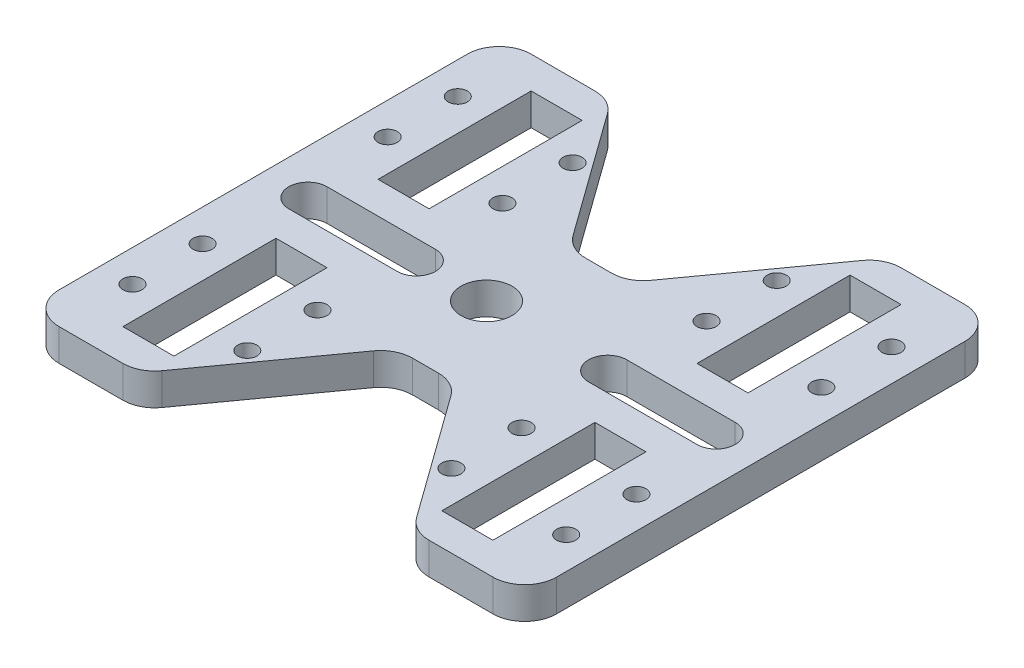
from build123d import *

# Parameters (mm, degrees)
ESBO_O1_W                = 78
ESBO_O1_H                = 74
ESBO_O1_R                = 1.5
ESBO_O1_W_2              = 8
ESBO_O1_H_2              = 24
RESSALTO_EXTRUS_O1_DEPTH = 2.5
CORTE_EXTRUS_O1_DEPTH    = 54.990739947
ESBO_O3_R                = 4
CORTE_EXTRUS_O2_DEPTH    = 10
FILETE1_R                = 5


with BuildPart() as part:
    # Esboço1 → Ressalto-extrusão1 (new, symmetric)
    with BuildSketch(Plane(origin=(0, 0, 0), x_dir=(1, 0, 0), z_dir=(0, 1, 0))):
        Rectangle(ESBO_O1_W, ESBO_O1_H)
        with Locations(Location((-34, 25.5, 0), (0, 0, 270))):
            Circle(ESBO_O1_R, mode=Mode.SUBTRACT)
        with Locations(Location((-16, 25.5, 0), (0, 0, 90))):
            Circle(ESBO_O1_R, mode=Mode.SUBTRACT)
        with Locations(Location((-16, 14.5, 0), (0, 0, 270))):
            Circle(ESBO_O1_R, mode=Mode.SUBTRACT)
        with Locations(Location((-34, 14.5, 0), (0, 0, 90))):
            Circle(ESBO_O1_R, mode=Mode.SUBTRACT)
        with Locations(Location((16, 14.5, 0), (0, 0, 90))):
            Circle(ESBO_O1_R, mode=Mode.SUBTRACT)
        with Locations(Location((16, 25.5, 0), (0, 0, 270))):
            Circle(ESBO_O1_R, mode=Mode.SUBTRACT)
        with Locations(Location((34, 14.5, 0), (0, 0, 270))):
            Circle(ESBO_O1_R, mode=Mode.SUBTRACT)
        with Locations(Location((34, 25.5, 0), (0, 0, 90))):
            Circle(ESBO_O1_R, mode=Mode.SUBTRACT)
        with Locations(Location((34, -14.5, 0), (0, 0, 90))):
            Circle(ESBO_O1_R, mode=Mode.SUBTRACT)
        with Locations(Location((16, -14.5, 0), (0, 0, 270))):
            Circle(ESBO_O1_R, mode=Mode.SUBTRACT)
        with Locations(Location((34, -25.5, 0), (0, 0, 270))):
            Circle(ESBO_O1_R, mode=Mode.SUBTRACT)
        with Locations(Location((16, -25.5, 0), (0, 0, 90))):
            Circle(ESBO_O1_R, mode=Mode.SUBTRACT)
        with Locations(Location((-16, -14.5, 0), (0, 0, 90))):
            Circle(ESBO_O1_R, mode=Mode.SUBTRACT)
        with Locations(Location((-16, -25.5, 0), (0, 0, 270))):
            Circle(ESBO_O1_R, mode=Mode.SUBTRACT)
        with Locations(Location((-34, -14.5, 0), (0, 0, 270))):
            Circle(ESBO_O1_R, mode=Mode.SUBTRACT)
        with Locations(Location((-34, -25.5, 0), (0, 0, 90))):
            Circle(ESBO_O1_R, mode=Mode.SUBTRACT)
        with Locations((-25, 20)):
            Rectangle(ESBO_O1_W_2, ESBO_O1_H_2, mode=Mode.SUBTRACT)
        with Locations((25, 20)):
            Rectangle(ESBO_O1_W_2, ESBO_O1_H_2, mode=Mode.SUBTRACT)
        with Locations((25, -20)):
            Rectangle(ESBO_O1_W_2, ESBO_O1_H_2, mode=Mode.SUBTRACT)
        with Locations((-25, -20)):
            Rectangle(ESBO_O1_W_2, ESBO_O1_H_2, mode=Mode.SUBTRACT)
    extrude(amount=RESSALTO_EXTRUS_O1_DEPTH, both=True)

    # Esboço2 → Corte-extrusão1 (cut, symmetric)
    with BuildSketch(Plane(origin=(0, 2.5, 0), x_dir=(1, 0, 0), z_dir=(0, 1, 0))):
        Polygon((-4.584870607, -13.571957621), (-21.450620651, -37), (21.450620651, -37), (4.584870607, -13.571957621), align=None)
    corte_extrus_o1 = extrude(amount=CORTE_EXTRUS_O1_DEPTH, both=True, mode=Mode.SUBTRACT)

    # Espelhar1: Corte-extrusão1 across plane
    add(corte_extrus_o1.mirror(Plane.XY), mode=Mode.SUBTRACT)

    # Esboço3 → Corte-extrusão2 (cut)
    with BuildSketch(Plane(origin=(0, 2.5, 0), x_dir=(1, 0, 0), z_dir=(0, 1, 0))):
        with Locations(Location((-4, 0, 0), (0, 0, 270))):
            Circle(ESBO_O3_R)
        with BuildLine():
            Line((-32, 3), (-15, 3))
            ThreePointArc((-15, 3), (-12, 0), (-15, -3))
            Line((-15, -3), (-32, -3))
            ThreePointArc((-32, -3), (-35, 0), (-32, 3))
        make_face()
        with BuildLine():
            Line((32, 3), (15, 3))
            ThreePointArc((15, 3), (12, 0), (15, -3))
            Line((15, -3), (32, -3))
            ThreePointArc((32, -3), (35, 0), (32, 3))
        make_face()
    extrude(amount=-CORTE_EXTRUS_O2_DEPTH, mode=Mode.SUBTRACT)

    # Filete1
    filete1_edges = [part.edges().sort_by_distance(p)[0] for p in [
        (21.450620651, 0, 37),
        (-21.450620651, 0, 37),
        (-4.584870607, 0, 13.571957621),
        (4.584870607, 0, 13.571957621),
        (21.450620651, 0, -37),
        (-21.450620651, 0, -37),
        (4.584870607, 0, -13.571957621),
        (-4.584870607, 0, -13.571957621),
        (39, 0, 37),
        (-39, 0, 37),
        (-39, 0, -37),
        (39, 0, -37),
    ]]
    fillet(filete1_edges, radius=FILETE1_R)


solid = part.part
